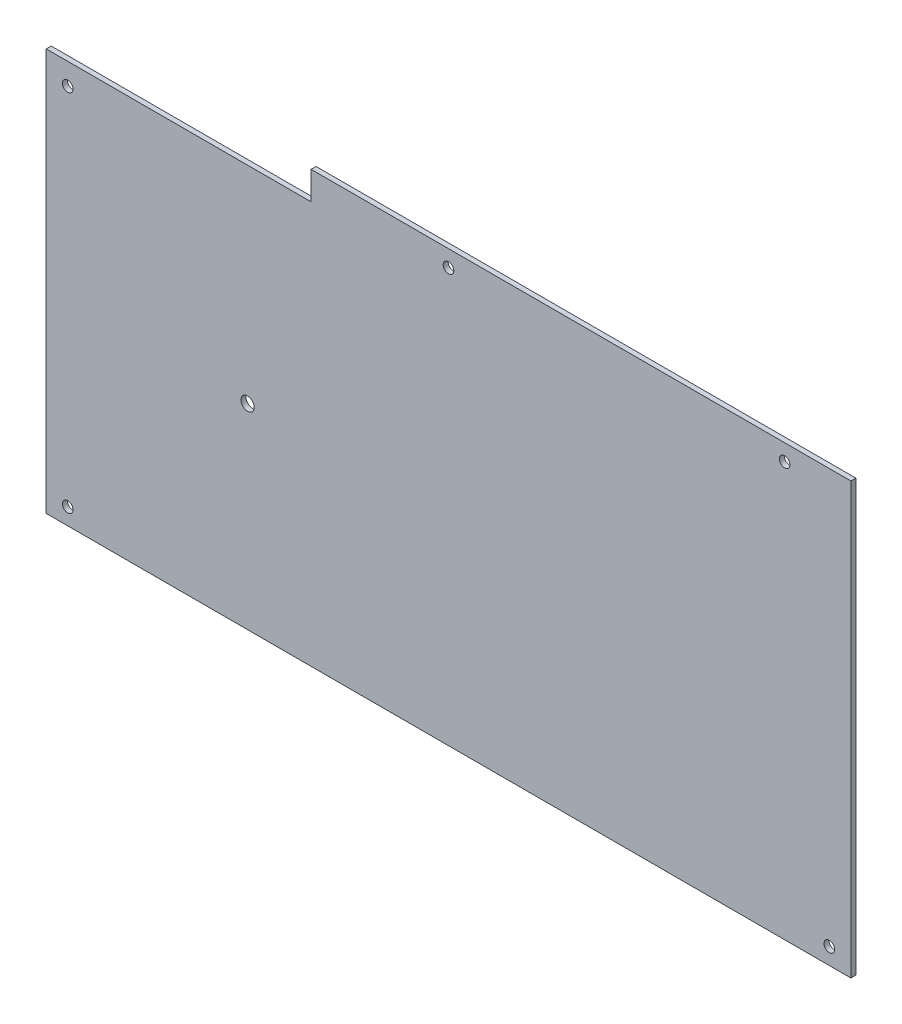
from build123d import *

# Parameters (mm, degrees)
SKETCH1_R           = 2
BOSS_EXTRUDE1_DEPTH = 1.5
SKETCH2_R           = 1.6
CUT_EXTRUDE1_DEPTH  = 1.5


with BuildPart() as part:
    # Sketch1 → Boss-Extrude1 (new body)
    with BuildSketch(Plane.XY):
        Polygon((-241.5, -120), (1.5, -120), (1.5, 10), (-161.5, 10), (-161.5, 1.5), (-241.5, 1.5), align=None)
        with Locations((-180.669950037, -60.870517352)):
            Circle(SKETCH1_R, mode=Mode.SUBTRACT)
    extrude(amount=BOSS_EXTRUDE1_DEPTH)

    # Sketch2 → Cut-Extrude1 (cut)
    with BuildSketch(Plane.XY.offset(1.5)):
        with Locations((-235, -5)):
            Circle(SKETCH2_R)
        with Locations((-235, -115)):
            Circle(SKETCH2_R)
        with Locations((-5, -115)):
            Circle(SKETCH2_R)
        with Locations((-120, 5)):
            Circle(SKETCH2_R)
        with Locations((-18.5, 5)):
            Circle(SKETCH2_R)
    extrude(amount=-CUT_EXTRUDE1_DEPTH, mode=Mode.SUBTRACT)


solid = part.part
